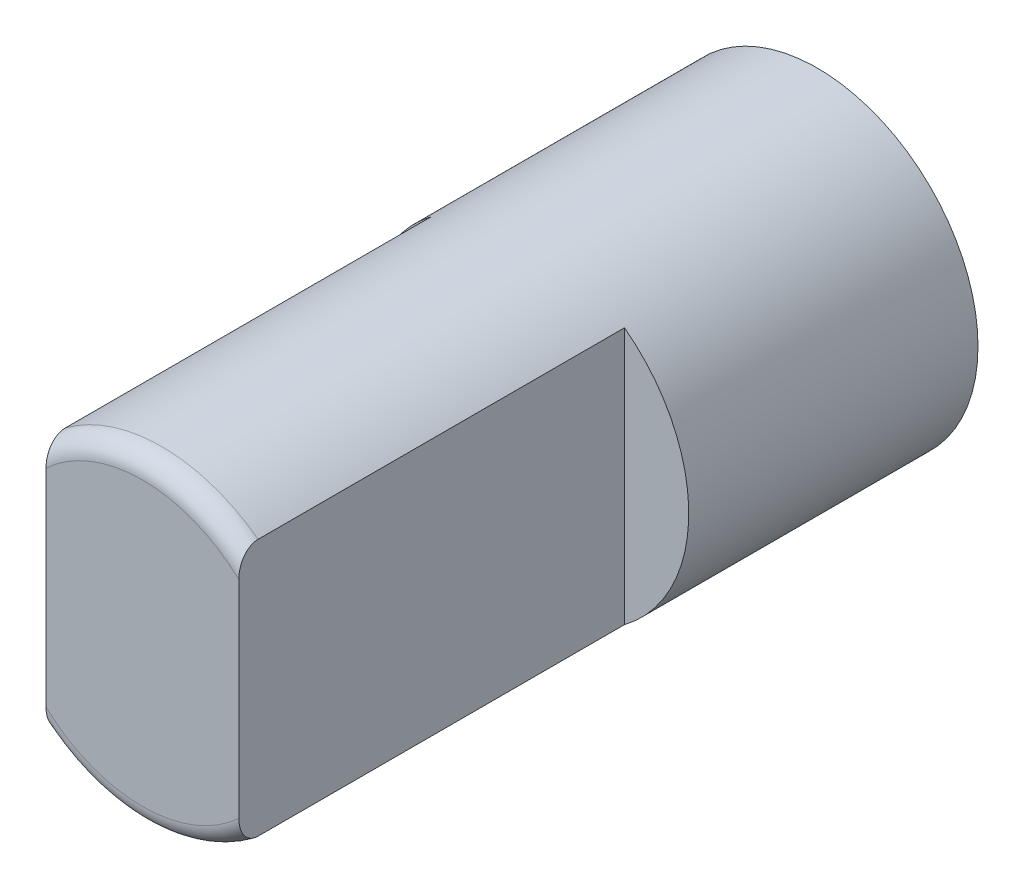
from build123d import *

# Parameters (mm, degrees)
ESQUISSE1_R             = 2.5
BOSS_EXTRU_1_DEPTH      = 10.5
ENL_V_START             = -6
ENL_V_MAT_EXTRU_2_DEPTH = 6
CONG_1_R                = 0.3


with BuildPart() as part:
    # Esquisse1 → Boss.-Extru.1 (new body)
    with BuildSketch(Plane.XY):
        with Locations(Location((0, 0, 0), (0, 0, 180))):
            Circle(ESQUISSE1_R)
    extrude(amount=BOSS_EXTRU_1_DEPTH)

    # Esquisse3 → Enlèv. mat.-Extru.2 (cut)
    with BuildSketch(Plane.XY.offset(10.5).offset(ENL_V_START)):
        with BuildLine():
            Line((1.5, 2), (1.5, -2))
            ThreePointArc((1.5, -2), (2.5, 0), (1.5, 2))
        make_face()
        with BuildLine():
            Line((-1.5, -2), (-1.5, 2))
            ThreePointArc((-1.5, 2), (-2.5, 0), (-1.5, -2))
        make_face()
    extrude(amount=ENL_V_MAT_EXTRU_2_DEPTH, mode=Mode.SUBTRACT)

    # Congé1
    cong_1_edges = [part.edges().sort_by_distance(p)[0] for p in [
        (0, 2.5, 10.5),
        (0, -2.5, 10.5),
    ]]
    fillet(cong_1_edges, radius=CONG_1_R)


solid = part.part
